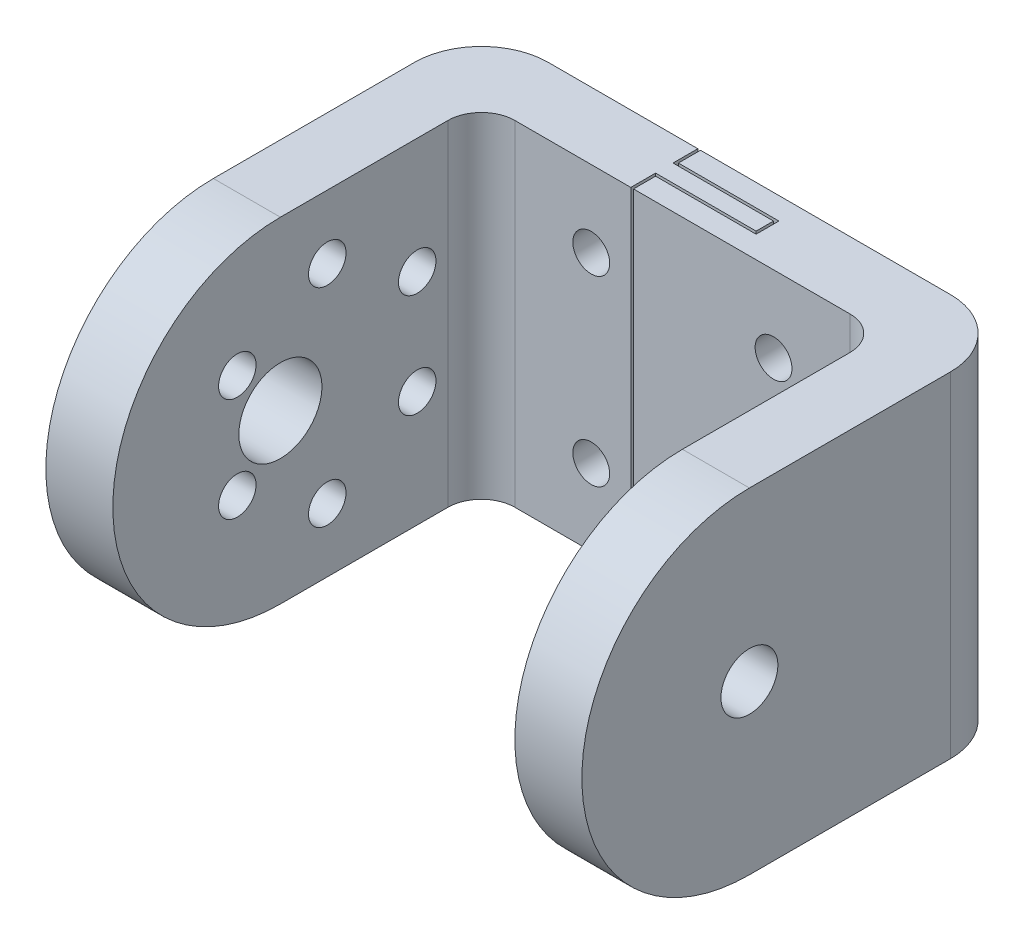
from build123d import *

# Parameters (mm, degrees)
SKETCH1_W                    = 10
SKETCH1_H                    = 55
SKETCH1_W_2                  = 60
SKETCH1_H_2                  = 10
BOSS_EXTRUDE1_DEPTH          = 50
SKETCH2_R                    = 2.75
CUT_EXTRUDE1_DEPTH           = 115.564392374
FILLET1_RADIUS               = 25
FILLET1_LENGTH               = 10
FILLET2_RADIUS               = 25
FILLET2_LENGTH               = 10
SKETCH3_R                    = 4.25
CUT_EXTRUDE2_DEPTH           = 10
SKETCH5_R                    = 6.2
SKETCH5_R_2                  = 1.7
CUT_EXTRUDE3_DEPTH           = 10
SKETCH7_R                    = 2.8
CUT_EXTRUDE4_DEPTH           = 5
FILLET3_R                    = 5
FILLET4_R                    = 10
CUT_EXTRUDE_THIN1_DEPTH      = 110.201648339
CUT_EXTRUDE_THIN1_DEPTH_BACK = 110.201648339


with BuildPart() as part:
    # Sketch1 → Boss-Extrude1 (new body)
    with BuildSketch(Plane(origin=(0, 0, 0), x_dir=(1, 0, 0), z_dir=(0, 1, 0))):
        with Locations((5, -27.5)):
            Rectangle(SKETCH1_W, SKETCH1_H)
        with Locations((40, 5)):
            Rectangle(SKETCH1_W_2, SKETCH1_H_2)
        with Locations((75, -27.5)):
            Rectangle(SKETCH1_W, SKETCH1_H)
        with Locations((75, 5)):
            Rectangle(SKETCH1_W, SKETCH1_H_2)
        with Locations((5, 5)):
            Rectangle(SKETCH1_W, SKETCH1_H_2)
    extrude(amount=BOSS_EXTRUDE1_DEPTH)

    # Sketch2 → Cut-Extrude1 (cut, through all)
    with BuildSketch(Plane(origin=(0, 0, -10), x_dir=(-1, 0, 0), z_dir=(0, 0, -1))):
        with Locations((-26.39526553, 38.60473447)):
            Circle(SKETCH2_R)
        with Locations((-53.60473447, 38.60473447)):
            Circle(SKETCH2_R)
        with Locations((-53.60473447, 11.39526553)):
            Circle(SKETCH2_R)
        with Locations((-26.39526553, 11.39526553)):
            Circle(SKETCH2_R)
    extrude(amount=-CUT_EXTRUDE1_DEPTH, mode=Mode.SUBTRACT)

    # Fillet1: full round fillet: the end face becomes a half cylinder, R = half its width
    fillet1_face = Plane((75, 25, 55), x_dir=(1, 0, 0), z_dir=(0, 0, 1))  # on the end face: x along it, z out of the body
    fillet1_slab = fillet1_face.offset(-FILLET1_RADIUS / 2) * Box(FILLET1_LENGTH, 2 * FILLET1_RADIUS, FILLET1_RADIUS, mode=Mode.PRIVATE)  # the body's end, R deep
    fillet1_round = Plane((75, 25, 30), x_dir=(0, 0, 1), z_dir=(1, 0, 0)) * Cylinder(FILLET1_RADIUS, FILLET1_LENGTH, mode=Mode.PRIVATE)  # its axis R under the face
    add(fillet1_slab - fillet1_round, mode=Mode.SUBTRACT)

    # Fillet2: full round fillet: the end face becomes a half cylinder, R = half its width
    fillet2_face = Plane((5, 25, 55), x_dir=(1, 0, 0), z_dir=(0, 0, 1))  # on the end face: x along it, z out of the body
    fillet2_slab = fillet2_face.offset(-FILLET2_RADIUS / 2) * Box(FILLET2_LENGTH, 2 * FILLET2_RADIUS, FILLET2_RADIUS, mode=Mode.PRIVATE)  # the body's end, R deep
    fillet2_round = Plane((5, 25, 30), x_dir=(0, 0, 1), z_dir=(1, 0, 0)) * Cylinder(FILLET2_RADIUS, FILLET2_LENGTH, mode=Mode.PRIVATE)  # its axis R under the face
    add(fillet2_slab - fillet2_round, mode=Mode.SUBTRACT)

    # Sketch3 → Cut-Extrude2 (cut)
    with BuildSketch(Plane(origin=(80, 0, 0), x_dir=(0, 0, -1), z_dir=(1, 0, 0))):
        with Locations((-30, 25)):
            Circle(SKETCH3_R)
    extrude(amount=-CUT_EXTRUDE2_DEPTH, mode=Mode.SUBTRACT)

    # Sketch5 → Cut-Extrude3 (cut)
    with BuildSketch(Plane.ZY):
        with Locations((30, 25)):
            Circle(SKETCH5_R)
        with Locations((23, 9.5)):
            Circle(SKETCH5_R_2)
        with Locations((9.576606241, 17.25)):
            Circle(SKETCH5_R_2)
        with Locations((9.576606241, 32.75)):
            Circle(SKETCH5_R_2)
        with Locations((23, 40.5)):
            Circle(SKETCH5_R_2)
        with Locations((36.423393759, 32.75)):
            Circle(SKETCH5_R_2)
        with Locations((36.423393759, 17.25)):
            Circle(SKETCH5_R_2)
    extrude(amount=-CUT_EXTRUDE3_DEPTH, mode=Mode.SUBTRACT)

    # Sketch7 → Cut-Extrude4 (cut)
    with BuildSketch(Plane(origin=(10, 0, 0), x_dir=(0, 0, -1), z_dir=(1, 0, 0))):
        with Locations((-23, 9.5)):
            Circle(SKETCH7_R)
        with Locations((-36.423393759, 17.25)):
            Circle(SKETCH7_R)
        with Locations((-36.423393759, 32.75)):
            Circle(SKETCH7_R)
        with Locations((-23, 40.5)):
            Circle(SKETCH7_R)
        with Locations((-9.576606241, 32.75)):
            Circle(SKETCH7_R)
        with Locations((-9.576606241, 17.25)):
            Circle(SKETCH7_R)
    extrude(amount=-CUT_EXTRUDE4_DEPTH, mode=Mode.SUBTRACT)

    # Fillet3
    fillet3_edges = [part.edges().sort_by_distance(p)[0] for p in [
        (70, 25, 0),
        (10, 25, 0),
    ]]
    fillet(fillet3_edges, radius=FILLET3_R)

    # Fillet4
    fillet4_edges = [part.edges().sort_by_distance(p)[0] for p in [
        (0, 25, -10),
        (80, 25, -10),
    ]]
    fillet(fillet4_edges, radius=FILLET4_R)

    # Sketch8 → Cut-Extrude-Thin1 (cut, two sides: drawn at the far end of the back side and taken through both)
    with BuildSketch(Plane(origin=(0, 50, 0), x_dir=(1, 0, 0), z_dir=(0, 1, 0)).offset(-CUT_EXTRUDE_THIN1_DEPTH_BACK)):
        Polygon((32.3, 10), (32.3, 6.3), (47.3, 6.3), (47.3, 3.7), (32.3, 3.7), (32.3, 0), (32.7, 0), (32.7, 3.3), (47.7, 3.3), (47.7, 6.7), (32.7, 6.7), (32.7, 10), align=None)
    extrude(amount=CUT_EXTRUDE_THIN1_DEPTH + CUT_EXTRUDE_THIN1_DEPTH_BACK, mode=Mode.SUBTRACT)


with BuildPart() as cut_extrude_thin1_piece_1:
    # of the separate pieces the step leaves, piece 1, a body of its own (cut_extrude_thin1_pieces)
    add(part.part.solids().sort_by_distance((80, 50, 0))[0])


with BuildPart() as cut_extrude_thin1_piece_2:
    # of the separate pieces the step leaves, piece 2, a body of its own (cut_extrude_thin1_pieces)
    add(part.part.solids().sort_by_distance((32.3, 50, -6.3))[0])


solid = Compound([cut_extrude_thin1_piece_1.part, cut_extrude_thin1_piece_2.part])
